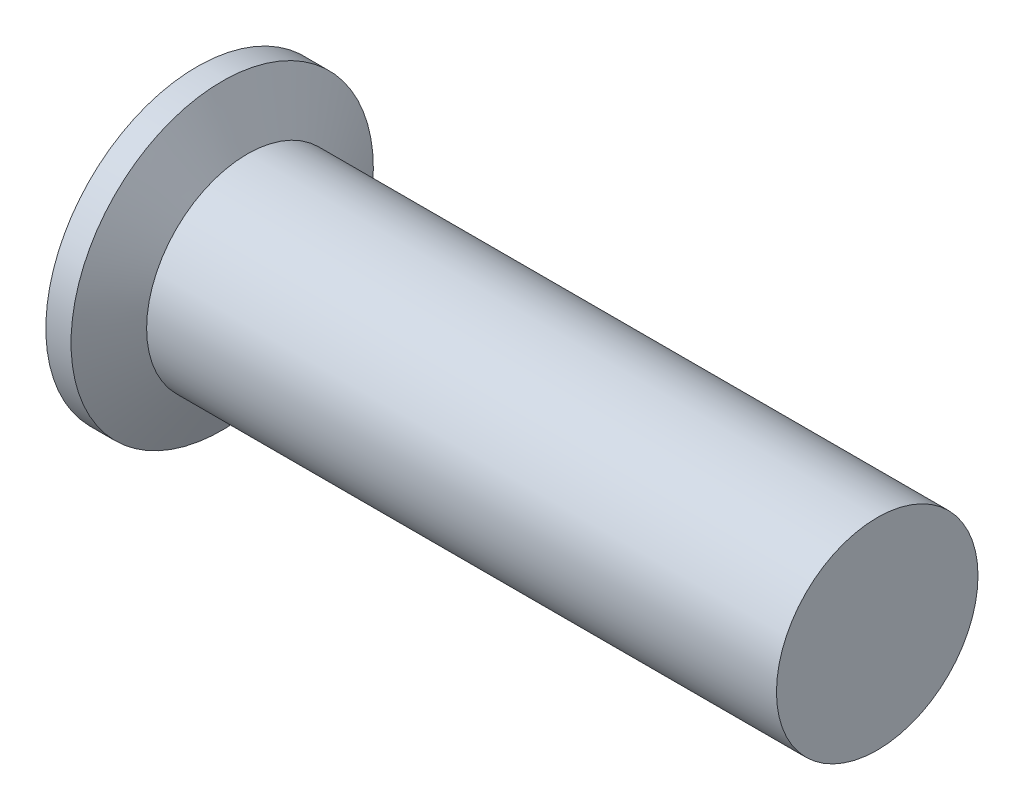
from build123d import *

# Parameters (mm, degrees)
SKETCH1_R           = 3
BOSS_EXTRUDE1_DEPTH = 1
SKETCH1_4_R         = 2
BOSS_EXTRUDE2_DEPTH = 13.5


with BuildPart() as part:
    # Sketch1 → Boss-Extrude1 (new body)
    with BuildSketch(Plane.YZ):
        Circle(SKETCH1_R)
    extrude(amount=BOSS_EXTRUDE1_DEPTH)

    # Sketch1<4> → Boss-Extrude2 (add)
    with BuildSketch(Plane.YZ):
        Circle(SKETCH1_4_R)
    extrude(amount=BOSS_EXTRUDE2_DEPTH)

    # Sketch2 → Cut-Revolve1 (revolve, cut)
    with BuildSketch(Plane(origin=(0, 0, 0), x_dir=(-1, 0, 0), z_dir=(0, 1, 0))):
        Polygon((-0.5, 3), (-1, 2), (-1, 3), align=None)
    revolve(axis=Axis((0.683677116, 0, 0), (-1, 0, 0)), mode=Mode.SUBTRACT)


solid = part.part
